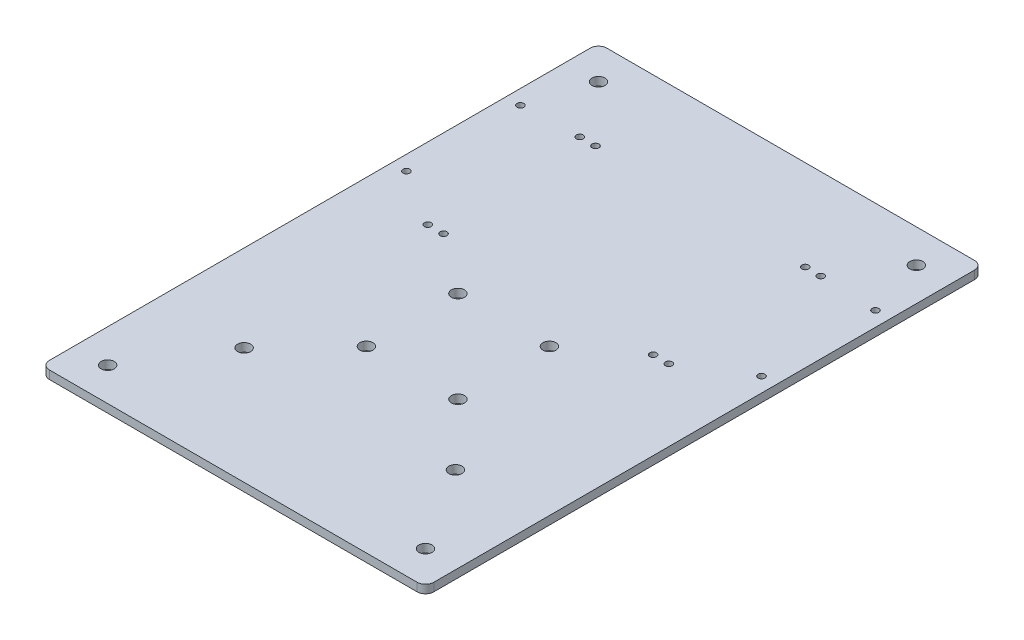
from build123d import *

# Parameters (mm, degrees)
SKETCH1_W           = 146.685
SKETCH1_H           = 212.725
SKETCH1_R           = 2.4892
BOSS_EXTRUDE1_DEPTH = 1.5875
FILLET1_R           = 3.175
SKETCH2_R           = 1.3
CUT_EXTRUDE1_DEPTH  = 130.236931012
SKETCH3_R           = 1.3
CUT_EXTRUDE2_DEPTH  = 130.236931012
SKETCH4_R           = 2.4892
CUT_EXTRUDE3_DEPTH  = 130.236931012
CUT_EXTRUDE4_REACH  = 131.237
SKETCH5_R           = 2.4892


with BuildPart() as part:
    # Sketch1 → Boss-Extrude1 (new, symmetric)
    with BuildSketch(Plane(origin=(0, 0, 0), x_dir=(1, 0, 0), z_dir=(0, 1, 0))):
        Rectangle(SKETCH1_W, SKETCH1_H)
        with Locations(Location((-60.6425, 93.6625, 0), (0, 0, 270))):
            Circle(SKETCH1_R, mode=Mode.SUBTRACT)
        with Locations(Location((60.6425, 93.6625, 0), (0, 0, 270))):
            Circle(SKETCH1_R, mode=Mode.SUBTRACT)
        with Locations(Location((60.6425, -93.6625, 0), (0, 0, 270))):
            Circle(SKETCH1_R, mode=Mode.SUBTRACT)
        with Locations(Location((-60.6425, -93.6625, 0), (0, 0, 270))):
            Circle(SKETCH1_R, mode=Mode.SUBTRACT)
    extrude(amount=BOSS_EXTRUDE1_DEPTH, both=True)

    # Fillet1
    fillet1_edges = [part.edges().sort_by_distance(p)[0] for p in [
        (73.3425, 0, 106.3625),
        (-73.3425, 0, 106.3625),
        (-73.3425, 0, -106.3625),
        (73.3425, 0, -106.3625),
    ]]
    fillet(fillet1_edges, radius=FILLET1_R)

    # Sketch2 → Cut-Extrude1 (cut, through all)
    with BuildSketch(Plane(origin=(0, 1.5875, 0), x_dir=(1, 0, 0), z_dir=(0, 1, 0))):
        with Locations(Location((40, 13.8625, 0), (0, 0, 270))):
            Circle(SKETCH2_R)
        with Locations(Location((40, 71.8625, 0), (0, 0, 270))):
            Circle(SKETCH2_R)
        with Locations(Location((-46, 71.8625, 0), (0, 0, 270))):
            Circle(SKETCH2_R)
        with Locations(Location((-46, 13.8625, 0), (0, 0, 270))):
            Circle(SKETCH2_R)
        with Locations(Location((46, 13.8625, 0), (0, 0, 270))):
            Circle(SKETCH2_R)
        with Locations(Location((46, 71.8625, 0), (0, 0, 270))):
            Circle(SKETCH2_R)
        with Locations(Location((-40, 71.8625, 0), (0, 0, 270))):
            Circle(SKETCH2_R)
        with Locations(Location((-40, 13.8625, 0), (0, 0, 270))):
            Circle(SKETCH2_R)
    extrude(amount=-CUT_EXTRUDE1_DEPTH, mode=Mode.SUBTRACT)

    # Sketch3 → Cut-Extrude2 (cut, through all)
    with BuildSketch(Plane(origin=(0, 1.5875, 0), x_dir=(1, 0, 0), z_dir=(0, 1, 0))):
        with Locations(Location((67.75, 70.962500061, 0), (0, 0, 270))):
            Circle(SKETCH3_R)
        with Locations(Location((-67.75, 70.962500061, 0), (0, 0, 270))):
            Circle(SKETCH3_R)
        with Locations(Location((-67.75, 27.462499939, 0), (0, 0, 270))):
            Circle(SKETCH3_R)
        with Locations(Location((67.75, 27.462499939, 0), (0, 0, 270))):
            Circle(SKETCH3_R)
    extrude(amount=-CUT_EXTRUDE2_DEPTH, mode=Mode.SUBTRACT)

    # Sketch4 → Cut-Extrude3 (cut, through all)
    with BuildSketch(Plane(origin=(0, 1.5875, 0), x_dir=(1, 0, 0), z_dir=(0, 1, 0))):
        with Locations(Location((-40.3225, -61.9125, 0), (0, 0, 270))):
            Circle(SKETCH4_R)
        with Locations(Location((40.3225, -61.9125, 0), (0, 0, 270))):
            Circle(SKETCH4_R)
    extrude(amount=-CUT_EXTRUDE3_DEPTH, mode=Mode.SUBTRACT)

    # Sketch5 → Cut-Extrude4 (cut, up to next)
    with BuildSketch(Plane(origin=(0, 1.5875, 0), x_dir=(1, 0, 0), z_dir=(0, 1, 0)), mode=Mode.PRIVATE) as cut_extrude4_sk1:
        with Locations(Location((17.4625, -38.1, 0), (0, 0, 270))):
            Circle(SKETCH5_R)
    cut_extrude4_tool1 = extrude(cut_extrude4_sk1.sketch, amount=-CUT_EXTRUDE4_REACH, mode=Mode.PRIVATE) & part.part
    # Sketch5 → Cut-Extrude4 (cut, up to next)
    with BuildSketch(Plane(origin=(0, 1.5875, 0), x_dir=(1, 0, 0), z_dir=(0, 1, 0)), mode=Mode.PRIVATE) as cut_extrude4_sk2:
        with Locations(Location((17.4625, -3.175, 0), (0, 0, 270))):
            Circle(SKETCH5_R)
    cut_extrude4_tool2 = extrude(cut_extrude4_sk2.sketch, amount=-CUT_EXTRUDE4_REACH, mode=Mode.PRIVATE) & part.part
    # Sketch5 → Cut-Extrude4 (cut, up to next)
    with BuildSketch(Plane(origin=(0, 1.5875, 0), x_dir=(1, 0, 0), z_dir=(0, 1, 0)), mode=Mode.PRIVATE) as cut_extrude4_sk3:
        with Locations(Location((-17.4625, -3.175, 0), (0, 0, 270))):
            Circle(SKETCH5_R)
    cut_extrude4_tool3 = extrude(cut_extrude4_sk3.sketch, amount=-CUT_EXTRUDE4_REACH, mode=Mode.PRIVATE) & part.part
    # Sketch5 → Cut-Extrude4 (cut, up to next)
    with BuildSketch(Plane(origin=(0, 1.5875, 0), x_dir=(1, 0, 0), z_dir=(0, 1, 0)), mode=Mode.PRIVATE) as cut_extrude4_sk4:
        with Locations(Location((-17.4625, -38.1, 0), (0, 0, 270))):
            Circle(SKETCH5_R)
    cut_extrude4_tool4 = extrude(cut_extrude4_sk4.sketch, amount=-CUT_EXTRUDE4_REACH, mode=Mode.PRIVATE) & part.part
    add(cut_extrude4_tool1.solids().sort_by_distance((17.4625, 1.5875, 38.1))[0], mode=Mode.SUBTRACT)
    add(cut_extrude4_tool2.solids().sort_by_distance((17.4625, 1.5875, 3.175))[0], mode=Mode.SUBTRACT)
    add(cut_extrude4_tool3.solids().sort_by_distance((-17.4625, 1.5875, 3.175))[0], mode=Mode.SUBTRACT)
    add(cut_extrude4_tool4.solids().sort_by_distance((-17.4625, 1.5875, 38.1))[0], mode=Mode.SUBTRACT)


solid = part.part
